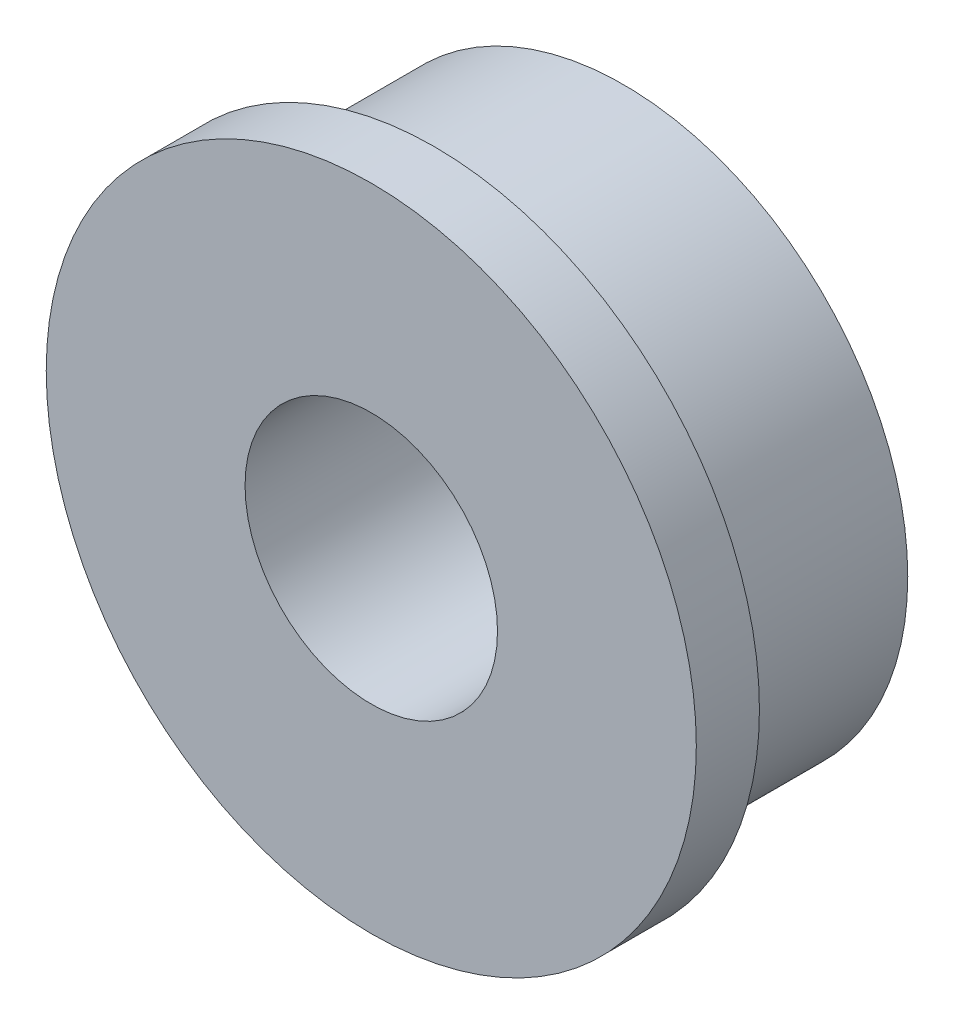
from build123d import *

# Parameters (mm, degrees)
SKETCH_1_R      = 4.5
SKETCH_1_R_2    = 2
EXTRUDE_1_DEPTH = 3
SKETCH_2_R      = 5.15
SKETCH_2_R_2    = 2
EXTRUDE_2_DEPTH = 1


with BuildPart() as part:
    # 草图1 → 凸台-拉伸1 (new body)
    with BuildSketch(Plane.XY):
        Circle(SKETCH_1_R)
        Circle(SKETCH_1_R_2, mode=Mode.SUBTRACT)
    extrude(amount=EXTRUDE_1_DEPTH)

    # 草图2 → 凸台-拉伸2 (add)
    with BuildSketch(Plane.XY.offset(3)):
        Circle(SKETCH_2_R)
        Circle(SKETCH_2_R_2, mode=Mode.SUBTRACT)
    extrude(amount=EXTRUDE_2_DEPTH)


solid = part.part
